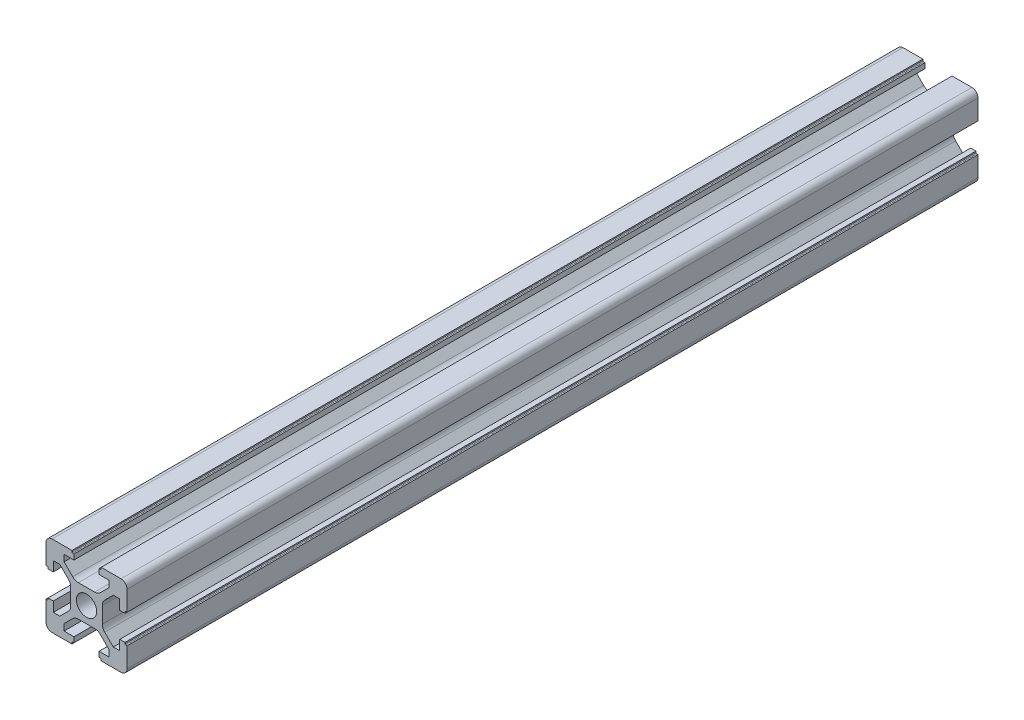
from build123d import *

# Parameters (mm, degrees)
SKETCH1_R       = 2.5
EXTRUDE_1_DEPTH = 210


with BuildPart() as part:
    # Sketch1 → Бобышка-Вытянуть1 (new body)
    with BuildSketch(Plane.XY):
        with BuildLine():
            Line((0, 3.9), (-2.010912703, 3.9))
            ThreePointArc((-2.010912703, 3.9), (-2.776279568, 4.052240935), (-3.425126266, 4.485786438))
            Line((-3.425126266, 4.485786438), (-5.539339828, 6.6))
            Line((-5.539339828, 6.6), (-5.539339828, 8.2))
            Line((-5.539339828, 8.2), (-3.1, 8.2))
            Line((-3.1, 8.2), (-3.1, 9.5))
            Line((-3.1, 9.5), (-3.4, 9.5))
            ThreePointArc((-3.4, 9.5), (-3.541421356, 9.558578644), (-3.6, 9.7))
            Line((-3.6, 9.7), (-3.6, 10))
            Line((-3.6, 10), (-8.5, 10))
            ThreePointArc((-8.5, 10), (-9.560660172, 9.560660172), (-10, 8.5))
            Line((-10, 8.5), (-10, 3.6))
            Line((-10, 3.6), (-9.7, 3.6))
            ThreePointArc((-9.7, 3.6), (-9.558578644, 3.541421356), (-9.5, 3.4))
            Line((-9.5, 3.4), (-9.5, 3.1))
            Line((-9.5, 3.1), (-8.2, 3.1))
            Line((-8.2, 3.1), (-8.2, 5.539339828))
            Line((-8.2, 5.539339828), (-6.6, 5.539339828))
            Line((-6.6, 5.539339828), (-4.485786438, 3.425126266))
            ThreePointArc((-4.485786438, 3.425126266), (-4.052240935, 2.776279568), (-3.9, 2.010912703))
            Line((-3.9, 2.010912703), (-3.9, 0))
            Line((-3.9, 0), (-3.9, -2.010912703))
            ThreePointArc((-3.9, -2.010912703), (-4.052240935, -2.776279568), (-4.485786438, -3.425126266))
            Line((-4.485786438, -3.425126266), (-6.6, -5.539339828))
            Line((-6.6, -5.539339828), (-8.2, -5.539339828))
            Line((-8.2, -5.539339828), (-8.2, -3.1))
            Line((-8.2, -3.1), (-9.5, -3.1))
            Line((-9.5, -3.1), (-9.5, -3.4))
            ThreePointArc((-9.5, -3.4), (-9.558578644, -3.541421356), (-9.7, -3.6))
            Line((-9.7, -3.6), (-10, -3.6))
            Line((-10, -3.6), (-10, -8.5))
            ThreePointArc((-10, -8.5), (-9.560660172, -9.560660172), (-8.5, -10))
            Line((-8.5, -10), (-3.6, -10))
            Line((-3.6, -10), (-3.6, -9.7))
            ThreePointArc((-3.6, -9.7), (-3.541421356, -9.558578644), (-3.4, -9.5))
            Line((-3.4, -9.5), (-3.1, -9.5))
            Line((-3.1, -9.5), (-3.1, -8.2))
            Line((-3.1, -8.2), (-5.539339828, -8.2))
            Line((-5.539339828, -8.2), (-5.539339828, -6.6))
            Line((-5.539339828, -6.6), (-3.425126266, -4.485786438))
            ThreePointArc((-3.425126266, -4.485786438), (-2.776279568, -4.052240935), (-2.010912703, -3.9))
            Line((-2.010912703, -3.9), (0, -3.9))
            Line((0, -3.9), (2.010912703, -3.9))
            ThreePointArc((2.010912703, -3.9), (2.776279568, -4.052240935), (3.425126266, -4.485786438))
            Line((3.425126266, -4.485786438), (5.539339828, -6.6))
            Line((5.539339828, -6.6), (5.539339828, -8.2))
            Line((5.539339828, -8.2), (3.1, -8.2))
            Line((3.1, -8.2), (3.1, -9.5))
            Line((3.1, -9.5), (3.4, -9.5))
            ThreePointArc((3.4, -9.5), (3.541421356, -9.558578644), (3.6, -9.7))
            Line((3.6, -9.7), (3.6, -10))
            Line((3.6, -10), (8.5, -10))
            ThreePointArc((8.5, -10), (9.560660172, -9.560660172), (10, -8.5))
            Line((10, -8.5), (10, -3.6))
            Line((10, -3.6), (9.7, -3.6))
            ThreePointArc((9.7, -3.6), (9.558578644, -3.541421356), (9.5, -3.4))
            Line((9.5, -3.4), (9.5, -3.1))
            Line((9.5, -3.1), (8.2, -3.1))
            Line((8.2, -3.1), (8.2, -5.539339828))
            Line((8.2, -5.539339828), (6.6, -5.539339828))
            Line((6.6, -5.539339828), (4.485786438, -3.425126266))
            ThreePointArc((4.485786438, -3.425126266), (4.052240935, -2.776279568), (3.9, -2.010912703))
            Line((3.9, -2.010912703), (3.9, 0))
            Line((3.9, 0), (3.9, 2.010912703))
            ThreePointArc((3.9, 2.010912703), (4.052240935, 2.776279568), (4.485786438, 3.425126266))
            Line((4.485786438, 3.425126266), (6.6, 5.539339828))
            Line((6.6, 5.539339828), (8.2, 5.539339828))
            Line((8.2, 5.539339828), (8.2, 3.1))
            Line((8.2, 3.1), (9.5, 3.1))
            Line((9.5, 3.1), (9.5, 3.4))
            ThreePointArc((9.5, 3.4), (9.558578644, 3.541421356), (9.7, 3.6))
            Line((9.7, 3.6), (10, 3.6))
            Line((10, 3.6), (10, 8.5))
            ThreePointArc((10, 8.5), (9.560660172, 9.560660172), (8.5, 10))
            Line((8.5, 10), (3.6, 10))
            Line((3.6, 10), (3.6, 9.7))
            ThreePointArc((3.6, 9.7), (3.541421356, 9.558578644), (3.4, 9.5))
            Line((3.4, 9.5), (3.1, 9.5))
            Line((3.1, 9.5), (3.1, 8.2))
            Line((3.1, 8.2), (5.539339828, 8.2))
            Line((5.539339828, 8.2), (5.539339828, 6.6))
            Line((5.539339828, 6.6), (3.425126266, 4.485786438))
            ThreePointArc((3.425126266, 4.485786438), (2.776279568, 4.052240935), (2.010912703, 3.9))
            Line((2.010912703, 3.9), (0, 3.9))
        make_face()
        Circle(SKETCH1_R, mode=Mode.SUBTRACT)
    extrude(amount=EXTRUDE_1_DEPTH)


solid = part.part
